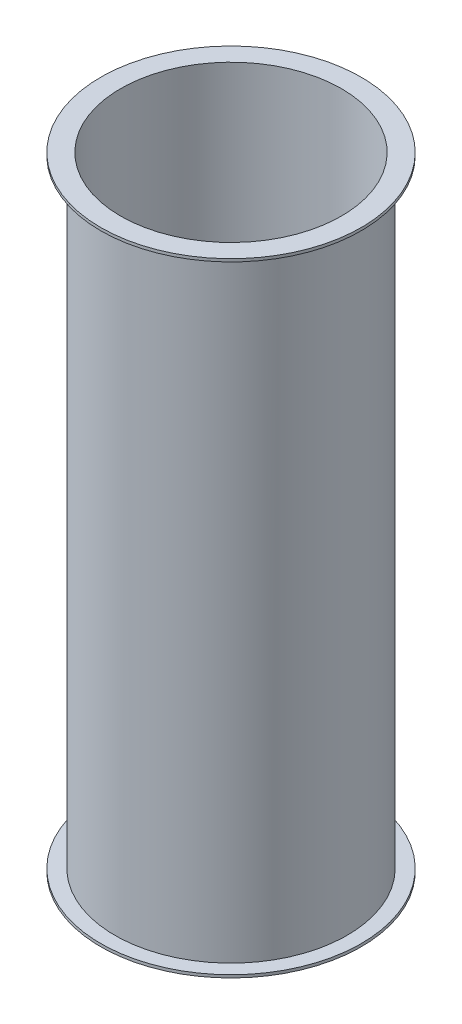
from build123d import *

# Parameters (mm, degrees)
SCHIZZO1_R                   = 41
SCHIZZO1_R_2                 = 39
ESTRUSIONE_SOTTILE1_DEPTH    = 110
SCHIZZO2_R                   = 46
SCHIZZO2_R_2                 = 41
ESTRUSIONE_ESTRUSIONE1_DEPTH = 1
ESTRUSIONE_ESTRUSIONE2_START = -1
SCHIZZO3_R                   = 46
SCHIZZO3_R_2                 = 41
ESTRUSIONE_ESTRUSIONE2_DEPTH = 1


with BuildPart() as part:
    # Schizzo1 → Estrusione-Sottile1 (new, symmetric)
    with BuildSketch(Plane(origin=(0, 0, 0), x_dir=(1, 0, 0), z_dir=(0, 1, 0))):
        Circle(SCHIZZO1_R)
        Circle(SCHIZZO1_R_2, mode=Mode.SUBTRACT)
    extrude(amount=ESTRUSIONE_SOTTILE1_DEPTH, both=True)

    # Schizzo2 → Estrusione-Estrusione1 (add)
    with BuildSketch(Plane(origin=(0, 110, 0), x_dir=(1, 0, 0), z_dir=(0, 1, 0))):
        with Locations(Location((0, 0, 0), (0, 0, 270))):
            Circle(SCHIZZO2_R)
        Circle(SCHIZZO2_R_2, mode=Mode.SUBTRACT)
    extrude(amount=-ESTRUSIONE_ESTRUSIONE1_DEPTH)

    # Schizzo3 → Estrusione-Estrusione2 (add)
    with BuildSketch(Plane.XZ.offset(110).offset(ESTRUSIONE_ESTRUSIONE2_START)):
        with Locations(Location((0, 0, 0), (0, 0, 90))):
            Circle(SCHIZZO3_R)
        with Locations(Location((0, 0, 0), (0, 0, 270))):
            Circle(SCHIZZO3_R_2, mode=Mode.SUBTRACT)
    extrude(amount=ESTRUSIONE_ESTRUSIONE2_DEPTH)


solid = part.part
